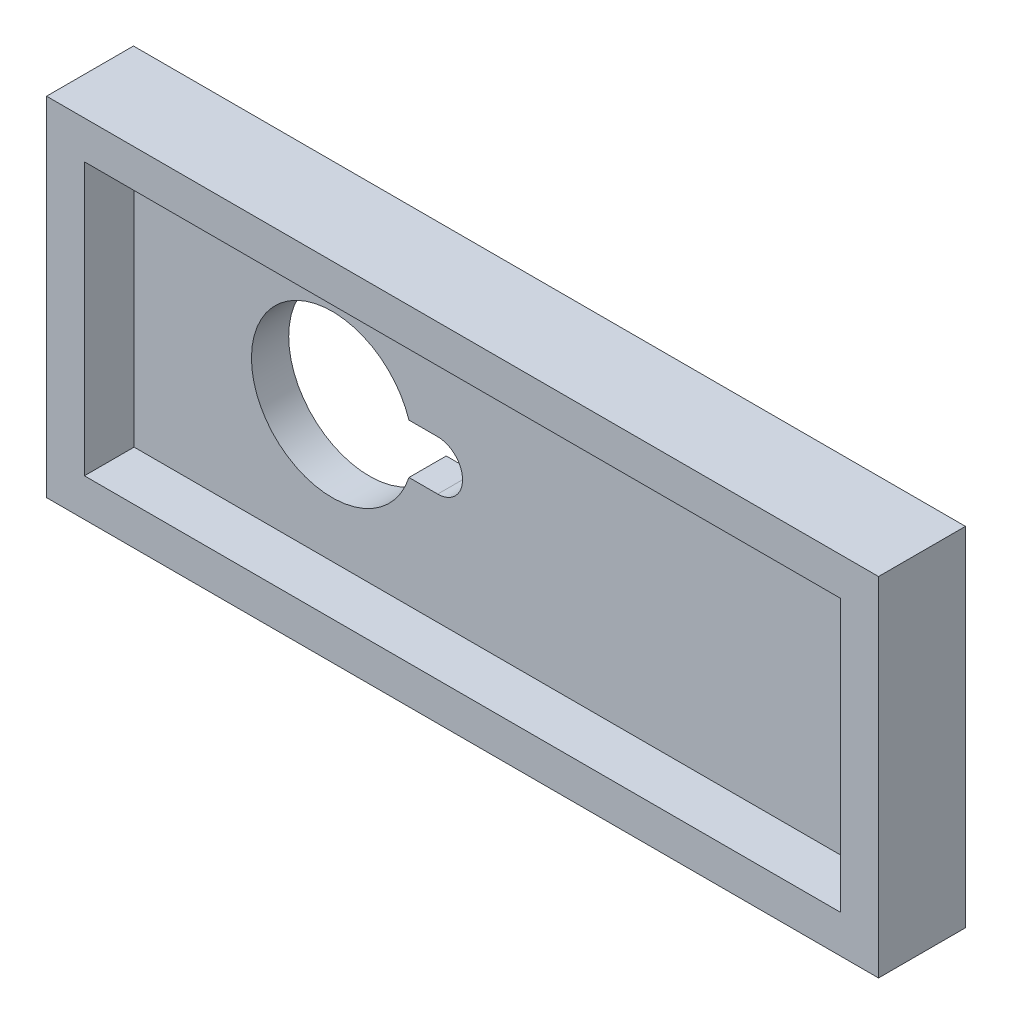
from build123d import *

# Parameters (mm, degrees)
CROQUIS1_W              = 67
CROQUIS1_H              = 28
SALIENTE_EXTRUIR1_DEPTH = 7
CROQUIS2_W              = 60.9
CROQUIS2_H              = 21.9
CORTAR_EXTRUIR1_DEPTH   = 4
CORTAR_EXTRUIR5_DEPTH   = 3


with BuildPart() as part:
    # Croquis1 → Saliente-Extruir1 (new body)
    with BuildSketch(Plane.XY):
        with Locations((-40.002156686, 17.680995475)):
            Rectangle(CROQUIS1_W, CROQUIS1_H)
    extrude(amount=SALIENTE_EXTRUIR1_DEPTH)

    # Croquis2 → Cortar-Extruir1 (cut)
    with BuildSketch(Plane.XY.offset(7)):
        with Locations((-40.002156686, 17.680995475)):
            Rectangle(CROQUIS2_W, CROQUIS2_H)
    extrude(amount=-CORTAR_EXTRUIR1_DEPTH, mode=Mode.SUBTRACT)

    # Croquis6 → Cortar-Extruir5 (cut)
    with BuildSketch(Plane(origin=(0, 0, 0), x_dir=(-1, 0, 0), z_dir=(0, 0, -1))):
        with BuildLine():
            Line((46.002156686, 15.680995475), (48.317498248, 15.680995475))
            ThreePointArc((48.317498248, 15.680995475), (61.002156686, 17.680995475), (48.317498248, 19.680995475))
            Line((48.317498248, 19.680995475), (46.002156686, 19.680995475))
            ThreePointArc((46.002156686, 19.680995475), (44.002156686, 17.680995475), (46.002156686, 15.680995475))
        make_face()
    extrude(amount=-CORTAR_EXTRUIR5_DEPTH, mode=Mode.SUBTRACT)


solid = part.part
